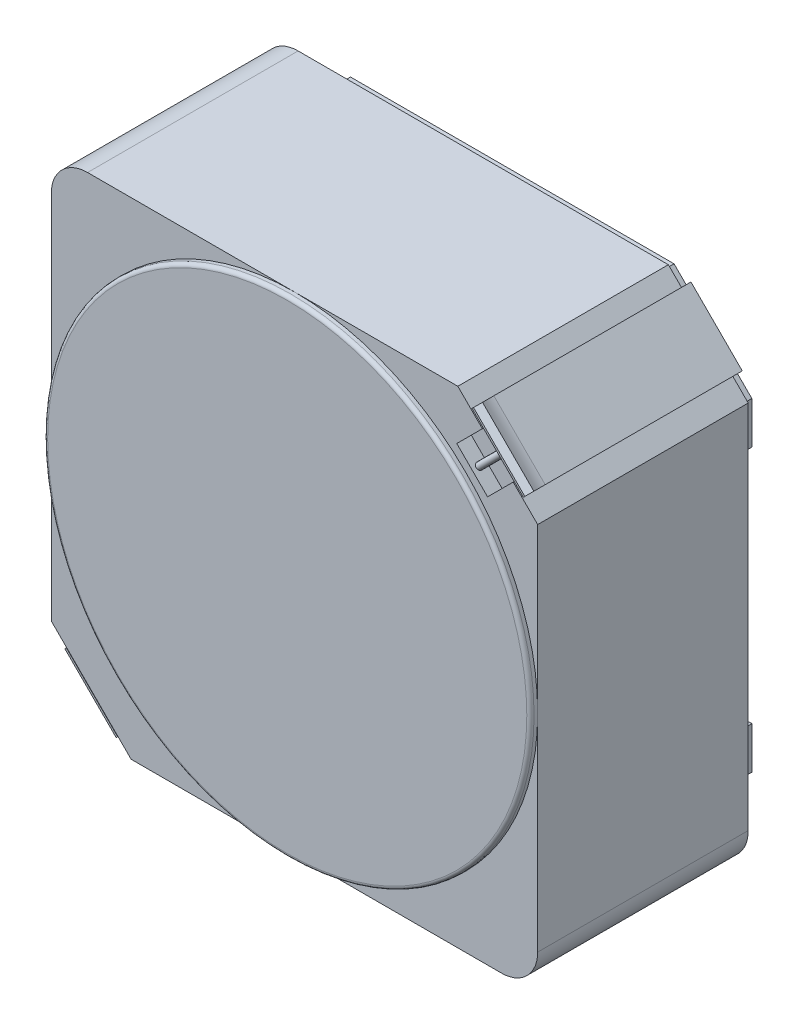
from build123d import *

# Parameters (mm, degrees)
EXTRUDE_START                      = 0.1
EXTRUDE_726_DEPTH                  = 2.9
EXTRUDE_1021_DEPTH                 = 0.1
EXTRUDE_1021_DEPTH_BACK            = 1
SKETCH_2_R                         = 3.35
FILLET_1_R                         = 0.05
EXTRUDE_START_2                    = -0.3
EXTRUDE_1608_DEPTH                 = 1
CUT_EXTRUDE_8_DEPTH                = 0.2
EXTRUDE_START_3                    = 0.05
SKETCH_9_R                         = 0.046
EXTRUDE_1_DEPTH                    = 0.461
EXTRUDE_1_OTHER_WAY_DEPTH          = 0.05
EXTRUDE_1_OTHER_WAY_DRAFT          = 45
PATTERN_CIRCULAR_3_COUNT           = 2
PATTERN_START                      = 0.05
PATTERN_CIRCULAR_3_COPY_1_SKETCH_R = 0.046
PATTERN_CIRCULAR_3_COPY_1_DEPTH    = 0.05
PATTERN_CIRCULAR_3_COPY_1_DRAFT    = 45
PATTERN_CIRCULAR_3_COPY_2_SKETCH_R = 0.046
PATTERN_CIRCULAR_3_COPY_2_DEPTH    = 0.05
PATTERN_CIRCULAR_3_COPY_2_DRAFT    = 45
EXTRUDE_4317_DEPTH                 = 0.1


with BuildPart() as part:
    # Эскиз1 → Extrude 726 (new body)
    with BuildSketch(Plane.XY.offset(EXTRUDE_START)):
        with BuildLine():
            Line((-3.35, -2.25), (-2.25, -3.35))
            Line((-2.25, -3.35), (2.85, -3.35))
            ThreePointArc((2.85, -3.35), (3.203553391, -3.203553391), (3.35, -2.85))
            Line((3.35, -2.85), (3.35, 2.25))
            Line((3.35, 2.25), (2.25, 3.35))
            Line((2.25, 3.35), (-2.85, 3.35))
            ThreePointArc((-2.85, 3.35), (-3.203553391, 3.203553391), (-3.35, 2.85))
            Line((-3.35, 2.85), (-3.35, -2.25))
        make_face()
    extrude(amount=EXTRUDE_726_DEPTH)

    # Эскиз2 → Extrude 1021 (add, two sides: drawn at the far end of the back side and taken through both)
    with BuildSketch(Plane.XY.offset(3).offset(-EXTRUDE_1021_DEPTH_BACK)):
        Circle(SKETCH_2_R)
    extrude(amount=EXTRUDE_1021_DEPTH + EXTRUDE_1021_DEPTH_BACK)

    # Скругление1
    fillet_1_edges = [part.edges().sort_by_distance(p)[0] for p in [
        (-3.35, 0, 3.1),
    ]]
    fillet(fillet_1_edges, radius=FILLET_1_R)

    # Эскиз6 → Extrude 1608 (add)
    with BuildSketch(Plane(origin=(0.55, -0.55, 0), x_dir=(0, 0, 1), z_dir=(0.7071067811865498, -0.7071067811865452, 0)).offset(EXTRUDE_START_2)):
        with BuildLine():
            Line((2.908, -4.054797975), (2.995, -4.002797975))
            Line((2.995, -4.002797975), (2.995, -3.972797975))
            Line((2.995, -3.972797975), (0.125, -3.972797975))
            Line((0.125, -3.972797975), (0.125, -3.472797975))
            Line((0.125, -3.472797975), (0, -3.472797975))
            Line((0, -3.472797975), (0, -4.002797975))
            Line((0, -4.002797975), (2.715, -4.002797975))
            add(Edge.make_bspline(
                [(2.715, -4.002797975), (2.818817166, -4.006572308), (2.908, -4.054797975)],
                knots=[0, 0, 0, 1, 1, 1], degree=2))
        make_face()
    extrude_1608 = extrude(amount=-EXTRUDE_1608_DEPTH)

    # Эскиз8 → Вытянуть8 (cut)
    with BuildSketch(Plane.XY.offset(3)):
        Polygon((3.012132034, 2.587867966), (2.587867966, 3.012132034), (2.235728789, 2.659992857), (2.659992857, 2.235728789), align=None)
        Polygon((-1.687867966, -2.112132034), (-1.348661774, -1.747518322), (-1.787955403, -1.338836163), (-2.127161595, -1.703449875), align=None)
    extrude(amount=-CUT_EXTRUDE_8_DEPTH, mode=Mode.SUBTRACT)

    # Эскиз9 → Бобышка-Вытянуть1 (add)
    with BuildSketch(Plane(origin=(2.809192388, 2.809192388, 0), x_dir=(0, 0, 1), z_dir=(-0.7071067811865452, -0.7071067811865498, 0)).offset(EXTRUDE_START_3)):
        with Locations(Location((2.899, 0, 0), (0, 0, 270))):
            Circle(SKETCH_9_R)
    extrude_1 = extrude(amount=EXTRUDE_1_DEPTH)


with BuildPart() as extrude_1_other_way_tool:
    # Эскиз9 → Бобышка-Вытянуть1 other way (with draft: the straight prism first)
    with BuildSketch(Plane(origin=(2.809192388, 2.809192388, 0), x_dir=(0, 0, 1), z_dir=(-0.7071067811865452, -0.7071067811865498, 0)).offset(EXTRUDE_START_3)):
        with Locations(Location((2.899, 0, 0), (0, 0, 270))):
            Circle(SKETCH_9_R)
    extrude(amount=-EXTRUDE_1_OTHER_WAY_DEPTH)
    # Бобышка-Вытянуть1 other way: the draft: its side faces are tilted about the plane it starts from
    extrude_1_other_way_sides = [extrude_1_other_way_tool.faces().sort_by_distance(p)[0] for p in [
        (2.758987807, 2.824041631, 2.899),
    ]]
    draft(extrude_1_other_way_sides, Plane(origin=(2.809192388, 2.809192388, 0), x_dir=(0, 0, 1), z_dir=(-0.7071067811865452, -0.7071067811865498, 0)).offset(EXTRUDE_START_3), EXTRUDE_1_OTHER_WAY_DRAFT)


with BuildPart() as part_1:
    add(part.part)

    # Бобышка-Вытянуть1 other way: add extrude_1_other_way_tool
    add(extrude_1_other_way_tool.part)

    # Круговой массив3: Extrude 1608, Бобышка-Вытянуть1 ×2 about axis
    pattern_circular_3_axis = Axis((0, 0, 3.1), (0, 0, -1))
    add([extrude_1608.rotate(pattern_circular_3_axis, i * 360 / PATTERN_CIRCULAR_3_COUNT) for i in range(1, PATTERN_CIRCULAR_3_COUNT)])
    add([extrude_1.rotate(pattern_circular_3_axis, i * 360 / PATTERN_CIRCULAR_3_COUNT) for i in range(1, PATTERN_CIRCULAR_3_COUNT)])


with BuildPart() as pattern_circular_3_copy_1_tool:
    # Круговой массив3 copy 1 sketch → Круговой массив3 copy 1 (with draft: the straight prism first)
    with BuildSketch(Plane(origin=(-2.809192388, -2.809192388, 0), x_dir=(0, 0, 1), z_dir=(0.7071067811865451, 0.7071067811865499, 0)).offset(PATTERN_START)):
        with Locations(Location((2.899, 0, 0), (0, 0, 270))):
            Circle(PATTERN_CIRCULAR_3_COPY_1_SKETCH_R)
    extrude(amount=-PATTERN_CIRCULAR_3_COPY_1_DEPTH)
    # Круговой массив3 copy 1: the draft: its side faces are tilted about the plane it starts from
    pattern_circular_3_copy_1_sides = [pattern_circular_3_copy_1_tool.faces().sort_by_distance(p)[0] for p in [
        (-2.758987807, -2.824041631, 2.899),
    ]]
    draft(pattern_circular_3_copy_1_sides, Plane(origin=(-2.809192388, -2.809192388, 0), x_dir=(0, 0, 1), z_dir=(0.7071067811865451, 0.7071067811865499, 0)).offset(PATTERN_START), PATTERN_CIRCULAR_3_COPY_1_DRAFT)


with BuildPart() as part_2:
    add(part_1.part)

    # Круговой массив3 copy 1: add pattern_circular_3_copy_1_tool
    add(pattern_circular_3_copy_1_tool.part)


with BuildPart() as pattern_circular_3_copy_2_tool:
    # Круговой массив3 copy 2 sketch → Круговой массив3 copy 2 (with draft: the straight prism first)
    with BuildSketch(Plane(origin=(-2.809192388, -2.809192388, 0), x_dir=(0, 0, 1), z_dir=(0.7071067811865451, 0.7071067811865499, 0)).offset(PATTERN_START)):
        with Locations(Location((2.899, 0, 0), (0, 0, 270))):
            Circle(PATTERN_CIRCULAR_3_COPY_2_SKETCH_R)
    extrude(amount=-PATTERN_CIRCULAR_3_COPY_2_DEPTH)
    # Круговой массив3 copy 2: the draft: its side faces are tilted about the plane it starts from
    pattern_circular_3_copy_2_sides = [pattern_circular_3_copy_2_tool.faces().sort_by_distance(p)[0] for p in [
        (-2.758987807, -2.824041631, 2.899),
    ]]
    draft(pattern_circular_3_copy_2_sides, Plane(origin=(-2.809192388, -2.809192388, 0), x_dir=(0, 0, 1), z_dir=(0.7071067811865451, 0.7071067811865499, 0)).offset(PATTERN_START), PATTERN_CIRCULAR_3_COPY_2_DRAFT)


with BuildPart() as part_3:
    add(part_2.part)

    # Круговой массив3 copy 2: add pattern_circular_3_copy_2_tool
    add(pattern_circular_3_copy_2_tool.part)

    # Эскиз13 → Extrude 4317 (add)
    with BuildSketch(Plane(origin=(0, 0, 0.1), x_dir=(-1, 0, 0), z_dir=(0, 0, -1))):
        with BuildLine():
            Line((2.32460701, 1.648848765), (3.3, 1.648848765))
            Line((3.3, 1.648848765), (3.3, 2.228848765))
            Line((3.3, 2.228848765), (2.228848765, 3.3))
            Line((2.228848765, 3.3), (-2.228848765, 3.3))
            Line((-2.228848765, 3.3), (-3.3, 2.228848765))
            Line((-3.3, 2.228848765), (-3.3, 1.648848765))
            Line((-3.3, 1.648848765), (-2.32460701, 1.648848765))
            ThreePointArc((-2.32460701, 1.648848765), (0, 2.85), (2.32460701, 1.648848765))
        make_face()
        with BuildLine():
            Line((-3.3, -1.648848765), (-2.32460701, -1.648848765))
            ThreePointArc((-2.32460701, -1.648848765), (0, -2.85), (2.32460701, -1.648848765))
            Line((2.32460701, -1.648848765), (3.3, -1.648848765))
            Line((3.3, -1.648848765), (3.3, -2.228848765))
            Line((3.3, -2.228848765), (2.228848765, -3.3))
            Line((2.228848765, -3.3), (-2.228848765, -3.3))
            Line((-2.228848765, -3.3), (-3.3, -2.228848765))
            Line((-3.3, -2.228848765), (-3.3, -1.648848765))
        make_face()
    extrude(amount=EXTRUDE_4317_DEPTH)


solid = part_3.part
